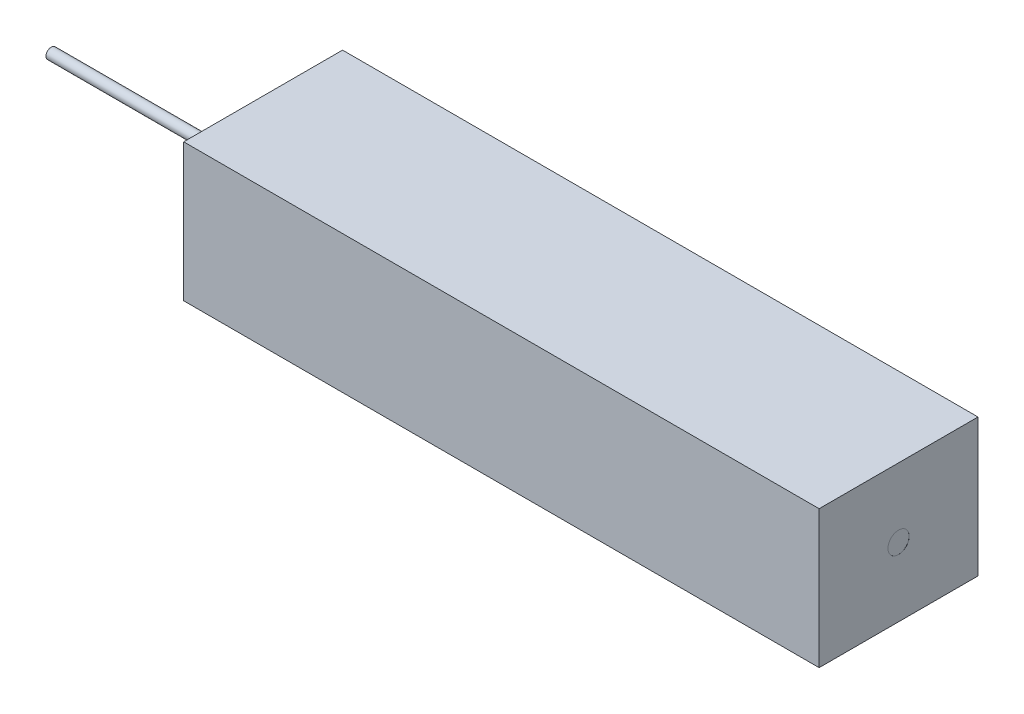
from build123d import *

# Parameters (mm, degrees)
SKETCH1_W           = 150
SKETCH1_H           = 130
BOSS_EXTRUDE1_DEPTH = 600
SKETCH2_R           = 5
BOSS_EXTRUDE2_DEPTH = 200
SKETCH3_R           = 10
CUT_EXTRUDE1_DEPTH  = 0.1


with BuildPart() as part:
    # Sketch1 → Boss-Extrude1 (new body)
    with BuildSketch(Plane(origin=(0, 0, 0), x_dir=(0, 0, -1), z_dir=(1, 0, 0))):
        Rectangle(SKETCH1_W, SKETCH1_H)
    extrude(amount=BOSS_EXTRUDE1_DEPTH)

    # Sketch2 → Boss-Extrude2 (add)
    with BuildSketch(Plane.ZY):
        Circle(SKETCH2_R)
    extrude(amount=BOSS_EXTRUDE2_DEPTH)

    # Sketch3 → Cut-Extrude1 (cut)
    with BuildSketch(Plane(origin=(600, 0, 0), x_dir=(0, 0, -1), z_dir=(1, 0, 0))):
        Circle(SKETCH3_R)
    extrude(amount=-CUT_EXTRUDE1_DEPTH, mode=Mode.SUBTRACT)


solid = part.part
